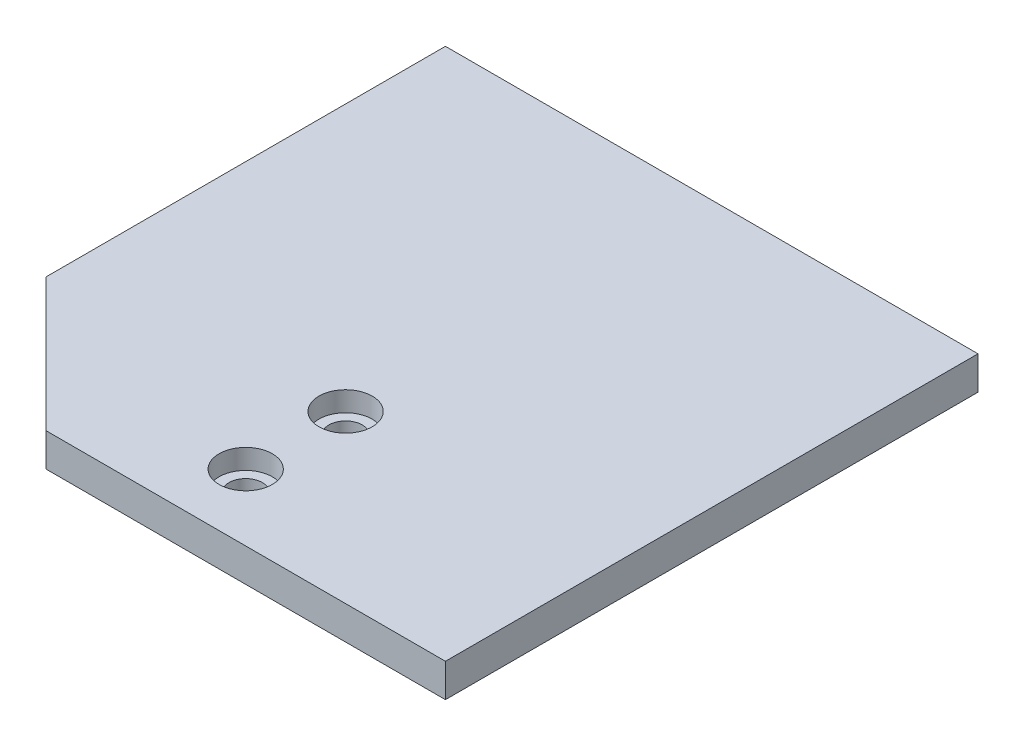
from build123d import *

# Parameters (mm, degrees)
BOSS_EXTRUDE1_DEPTH = 5
SKETCH2_R           = 2.5
CUT_EXTRUDE1_DEPTH  = 15
SKETCH3_R           = 4
CUT_EXTRUDE2_DEPTH  = 3


with BuildPart() as part:
    # Sketch1 → Boss-Extrude1 (new body)
    with BuildSketch(Plane(origin=(0, 0, 0), x_dir=(1, 0, 0), z_dir=(0, 1, 0))):
        Polygon((40, -40), (-20, -40), (-40, -20), (-40, 40), (40, 40), align=None)
    extrude(amount=BOSS_EXTRUDE1_DEPTH)

    # Sketch2 → Cut-Extrude1 (cut)
    with BuildSketch(Plane(origin=(0, 5, 0), x_dir=(1, 0, 0), z_dir=(0, 1, 0))):
        with Locations(Location((0, -15, 0), (0, 0, 270))):
            Circle(SKETCH2_R)
        with Locations(Location((0, -30, 0), (0, 0, 270))):
            Circle(SKETCH2_R)
    extrude(amount=-CUT_EXTRUDE1_DEPTH, mode=Mode.SUBTRACT)

    # Sketch3 → Cut-Extrude2 (cut)
    with BuildSketch(Plane(origin=(0, 5, 0), x_dir=(1, 0, 0), z_dir=(0, 1, 0))):
        with Locations(Location((0, -15, 0), (0, 0, 270))):
            Circle(SKETCH3_R)
        with Locations(Location((0, -30, 0), (0, 0, 270))):
            Circle(SKETCH3_R)
    extrude(amount=-CUT_EXTRUDE2_DEPTH, mode=Mode.SUBTRACT)


solid = part.part
